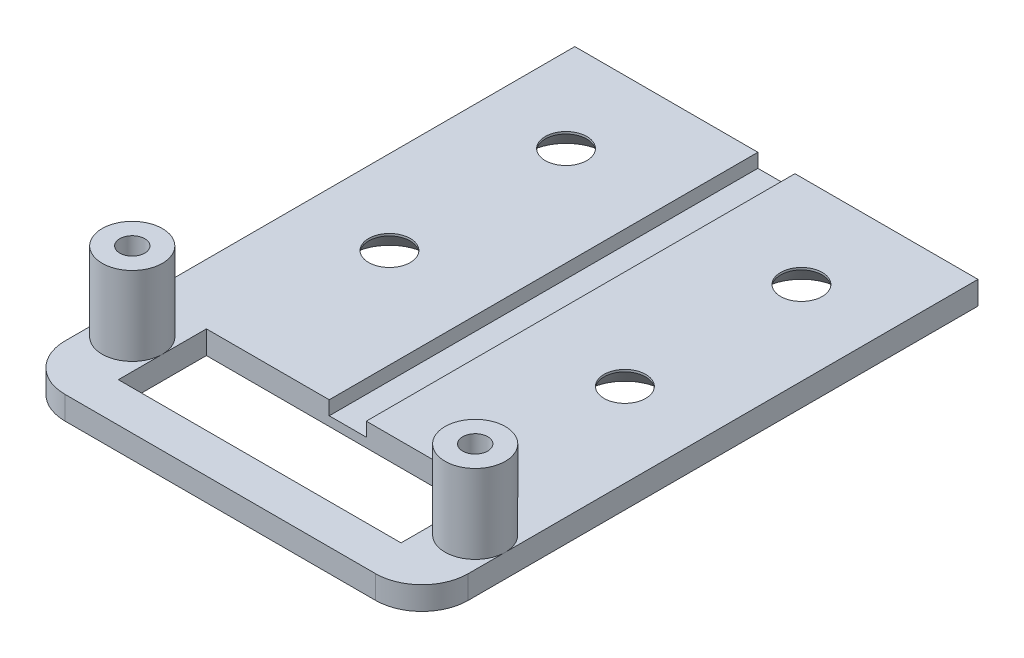
from build123d import *

# Parameters (mm, degrees)
SKETCH2_W                                      = 43.5
SKETCH2_H                                      = 60
BOSS_EXTRUDE1_DEPTH                            = 2.5
SKETCH3_W                                      = 30.5
SKETCH3_H                                      = 9.5
CUT_EXTRUDE1_DEPTH                             = 38.13909665
SKETCH4_R                                      = 3.25
BOSS_EXTRUDE2_DEPTH                            = 8.5
TAP_DRILL_FOR_M3X0_5_TAP1_D                    = 2.7
FILLET1_R                                      = 5
SKETCH7_W                                      = 4
SKETCH7_H                                      = 46.25
CUT_EXTRUDE2_DEPTH                             = 1.5
CSK_FOR_8_FLAT_HEAD_MACHINE_SCREW1_D           = 4.4958
CSK_FOR_8_FLAT_HEAD_MACHINE_SCREW1_CSINK_D     = 8.4328
CSK_FOR_8_FLAT_HEAD_MACHINE_SCREW1_CSINK_ANGLE = 82


with BuildPart() as part:
    # Sketch2 → Boss-Extrude1 (new body)
    with BuildSketch(Plane(origin=(0, 0, 0), x_dir=(1, 0, 0), z_dir=(0, 1, 0))):
        Rectangle(SKETCH2_W, SKETCH2_H)
    extrude(amount=BOSS_EXTRUDE1_DEPTH)

    # Sketch3 → Cut-Extrude1 (cut, through all)
    with BuildSketch(Plane(origin=(0, 2.5, 0), x_dir=(1, 0, 0), z_dir=(0, 1, 0))):
        with Locations((0, -21)):
            Rectangle(SKETCH3_W, SKETCH3_H)
    extrude(amount=-CUT_EXTRUDE1_DEPTH, mode=Mode.SUBTRACT)

    # Sketch4 → Boss-Extrude2 (add)
    with BuildSketch(Plane(origin=(0, 2.5, 0), x_dir=(1, 0, 0), z_dir=(0, 1, 0))):
        with Locations(Location((-18.5, -21, 0), (0, 0, 180))):
            Circle(SKETCH4_R)
        with Locations(Location((18.5, -21, 0), (0, 0, 180))):
            Circle(SKETCH4_R)
    extrude(amount=BOSS_EXTRUDE2_DEPTH)

    # Tap Drill for M3x0.5 Tap1 (through all)
    with Locations(Plane(origin=(0, 11, 0), x_dir=(1, 0, 0), z_dir=(0, 1, 0))):
        with Locations((-18.5, -21), (18.5, -21)):
            Hole(TAP_DRILL_FOR_M3X0_5_TAP1_D / 2)

    # Fillet1
    fillet1_edges = [part.edges().sort_by_distance(p)[0] for p in [
        (21.75, 1.25, 30),
        (-21.75, 1.25, 30),
    ]]
    fillet(fillet1_edges, radius=FILLET1_R)

    # Sketch7 → Cut-Extrude2 (cut)
    with BuildSketch(Plane(origin=(0, 2.5, 0), x_dir=(1, 0, 0), z_dir=(0, 1, 0))):
        with Locations((0, 6.875)):
            Rectangle(SKETCH7_W, SKETCH7_H)
    extrude(amount=-CUT_EXTRUDE2_DEPTH, mode=Mode.SUBTRACT)

    # CSK for #8 Flat Head Machine Screw1 (through all)
    with Locations(Plane(origin=(0, 0, 0), x_dir=(-1, 0, 0), z_dir=(0, -1, 0))):
        with Locations((-12.7, 0.95), (-12.7, 20), (12.7, 0.95), (12.7, 20)):
            CounterSinkHole(CSK_FOR_8_FLAT_HEAD_MACHINE_SCREW1_D / 2, CSK_FOR_8_FLAT_HEAD_MACHINE_SCREW1_CSINK_D / 2, counter_sink_angle=CSK_FOR_8_FLAT_HEAD_MACHINE_SCREW1_CSINK_ANGLE)


solid = part.part
